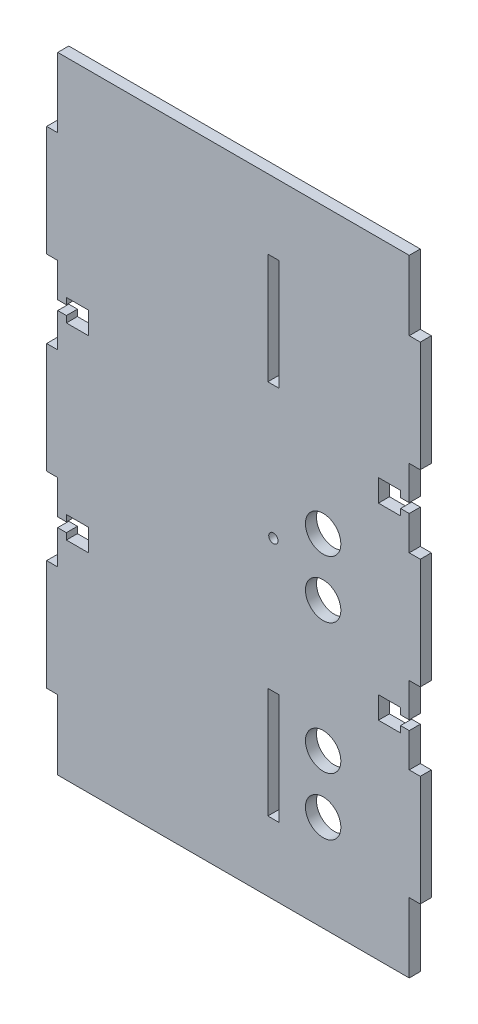
from build123d import *

# Parameters (mm, degrees)
ESQUISSE1_R        = 2.1
ESQUISSE1_R_2      = 8
ESQUISSE1_W        = 5
ESQUISSE1_H        = 50
BOSS_EXTRU_1_DEPTH = 5


with BuildPart() as part:
    # Esquisse1 → Boss.-Extru.1 (new body)
    with BuildSketch(Plane.XY):
        Polygon((0, -3.53), (0, -35), (-5, -35), (-5, -85), (0, -85), (0, -100.4), (3.918484905, -100.4), (3.918484905, -97.5), (13.918484905, -97.5), (13.918484905, -107.5), (3.918484905, -107.5), (3.918484905, -104.6), (0, -104.6), (0, -120), (-5, -120), (-5, -170), (0, -170), (0, -185.4), (3.918484905, -185.4), (3.918484905, -182.5), (13.918484905, -182.5), (13.918484905, -192.5), (3.918484905, -192.5), (3.918484905, -189.6), (0, -189.6), (0, -205), (-5, -205), (-5, -255), (0, -255), (0, -286.47), (158.918484905, -286.47), (158.918484905, -255), (163.918484905, -255), (163.918484905, -205), (158.918484905, -205), (158.918484905, -189.6), (155, -189.6), (155, -192.5), (145, -192.5), (145, -182.5), (155, -182.5), (155, -185.4), (158.918484905, -185.4), (158.918484905, -170), (163.918484905, -170), (163.918484905, -120), (158.918484905, -120), (158.918484905, -104.6), (155, -104.6), (155, -107.5), (145, -107.5), (145, -97.5), (155, -97.5), (155, -100.4), (158.918484905, -100.4), (158.918484905, -85), (163.918484905, -85), (163.918484905, -35), (158.918484905, -35), (158.918484905, -3.53), align=None)
        with Locations((97.5, -145)):
            Circle(ESQUISSE1_R, mode=Mode.SUBTRACT)
        with Locations((120, -132)):
            Circle(ESQUISSE1_R_2, mode=Mode.SUBTRACT)
        with Locations(Location((120, -158, 0), (0, 0, 180))):
            Circle(ESQUISSE1_R_2, mode=Mode.SUBTRACT)
        with Locations((120, -217)):
            Circle(ESQUISSE1_R_2, mode=Mode.SUBTRACT)
        with Locations(Location((120, -243, 0), (0, 0, 180))):
            Circle(ESQUISSE1_R_2, mode=Mode.SUBTRACT)
        with Locations((97.5, -60)):
            Rectangle(ESQUISSE1_W, ESQUISSE1_H, mode=Mode.SUBTRACT)
        with Locations((97.5, -230)):
            Rectangle(ESQUISSE1_W, ESQUISSE1_H, mode=Mode.SUBTRACT)
    extrude(amount=BOSS_EXTRU_1_DEPTH)


solid = part.part
